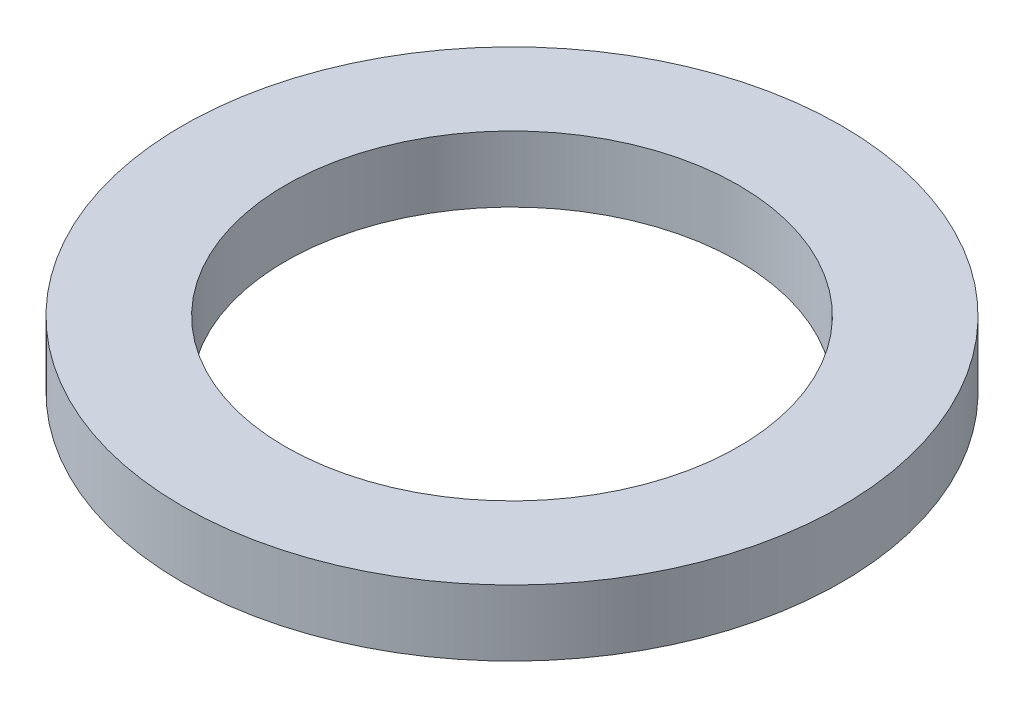
from build123d import *

# Parameters (mm, degrees)
SKETCH1_R           = 16
SKETCH1_R_2         = 11
BOSS_EXTRUDE1_DEPTH = 1.6


with BuildPart() as part:
    # Sketch1 → Boss-Extrude1 (new, symmetric)
    with BuildSketch(Plane(origin=(0, 0, 0), x_dir=(1, 0, 0), z_dir=(0, 1, 0))):
        with Locations(Location((0, 0, 0), (0, 0, 270))):
            Circle(SKETCH1_R)
        with Locations(Location((0, 0, 0), (0, 0, 270))):
            Circle(SKETCH1_R_2, mode=Mode.SUBTRACT)
    extrude(amount=BOSS_EXTRUDE1_DEPTH, both=True)


solid = part.part
